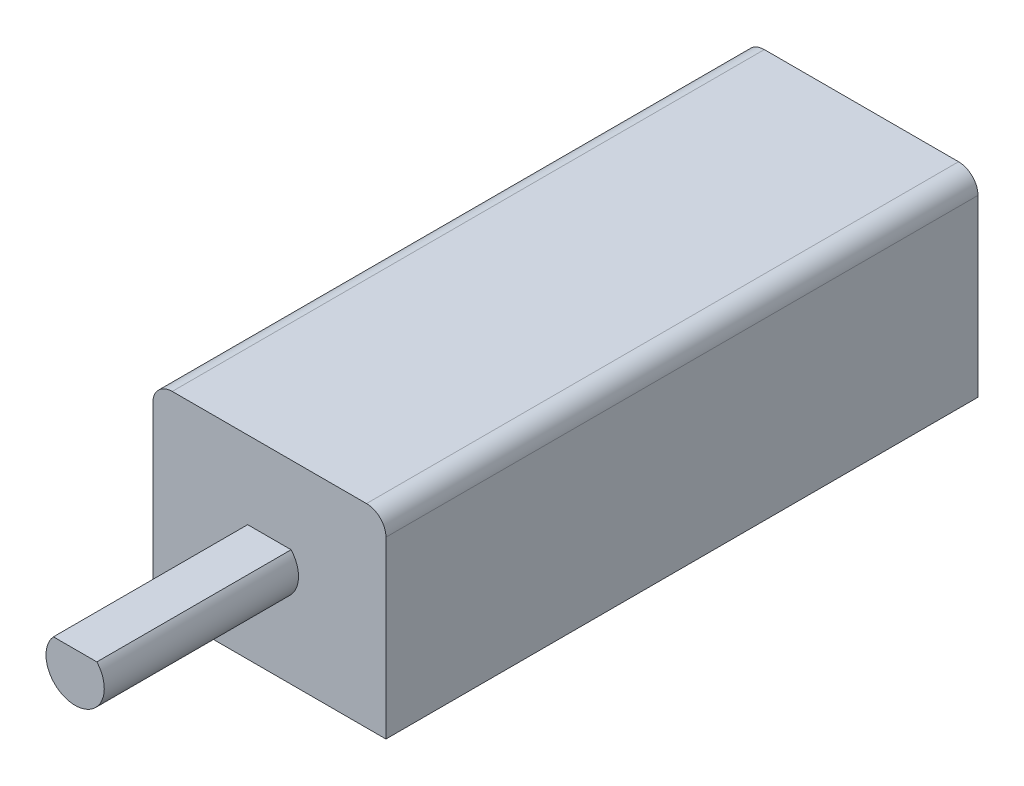
from build123d import *

# Parameters (mm, degrees)
SKETCH1_W           = 12
SKETCH1_H           = 10
BOSS_EXTRUDE1_DEPTH = 40.48
SKETCH2_OUTSIDE_W   = 22.678
SKETCH2_OUTSIDE_H   = 20.678
CUT_EXTRUDE1_DEPTH  = 10
FILLET1_R           = 1


with BuildPart() as part:
    # Sketch1 → Boss-Extrude1 (new body)
    with BuildSketch(Plane.XY):
        Rectangle(SKETCH1_W, SKETCH1_H)
    extrude(amount=-BOSS_EXTRUDE1_DEPTH)

    # Sketch2 outside → Cut-Extrude1 (cut)
    with BuildSketch(Plane.XY):
        Rectangle(SKETCH2_OUTSIDE_W, SKETCH2_OUTSIDE_H)
        with BuildLine():
            Line((-1.118033989, 1), (1.118033989, 1))
            ThreePointArc((1.118033989, 1), (0, -1.5), (-1.118033989, 1))
        make_face(mode=Mode.SUBTRACT)
    extrude(amount=-CUT_EXTRUDE1_DEPTH, mode=Mode.SUBTRACT)

    # Fillet1
    fillet1_edges = [part.edges().sort_by_distance(p)[0] for p in [
        (-6, 5, -25.24),
        (6, 5, -25.24),
    ]]
    fillet(fillet1_edges, radius=FILLET1_R)


solid = part.part
